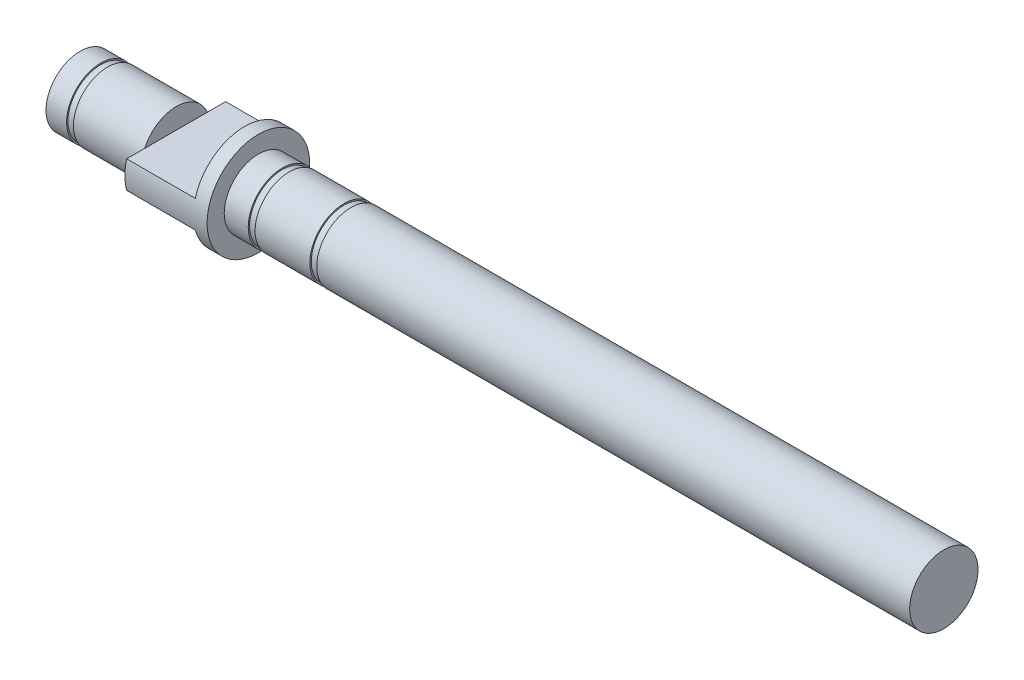
from build123d import *

# Parameters (mm, degrees)
CUT_EXTRUDE8_DEPTH = 10


with BuildPart() as part:
    # Sketch3 → Revolve1 (revolve)
    with BuildSketch(Plane(origin=(0, 0, 0), x_dir=(1, 0, 0), z_dir=(0, 1, 0)), mode=Mode.PRIVATE) as revolve1_sk:
        Polygon((0, 0), (126, 0), (126, 4.99), (39.5, 4.99), (39.5, 4.79), (38.5, 4.79), (38.5, 4.99), (30.5, 4.99), (30.5, 4.79), (29.5, 4.79), (29.5, 4.99), (26, 4.99), (26, 7.49), (14, 7.49), (14, 4.99), (4, 4.99), (4, 4.79), (3, 4.79), (3, 4.99), (0, 4.99), align=None)
    revolve(revolve1_sk.sketch.rotate(Axis((0, 0, 0), (1, 0, 0)), 180), axis=Axis((0, 0, 0), (1, 0, 0)))

    # Sketch10 → Cut-Extrude8 (cut)
    with BuildSketch(Plane.ZY.offset(-14)):
        with BuildLine():
            Line((7.228416147, 2), (-7.228416147, 2))
            ThreePointArc((-7.228416147, 2), (0, 7.5), (7.228416147, 2))
        make_face()
        with BuildLine():
            Line((7.228416147, -2), (-7.228416147, -2))
            ThreePointArc((-7.228416147, -2), (0, -7.5), (7.228416147, -2))
        make_face()
    extrude(amount=-CUT_EXTRUDE8_DEPTH, mode=Mode.SUBTRACT)


solid = part.part
